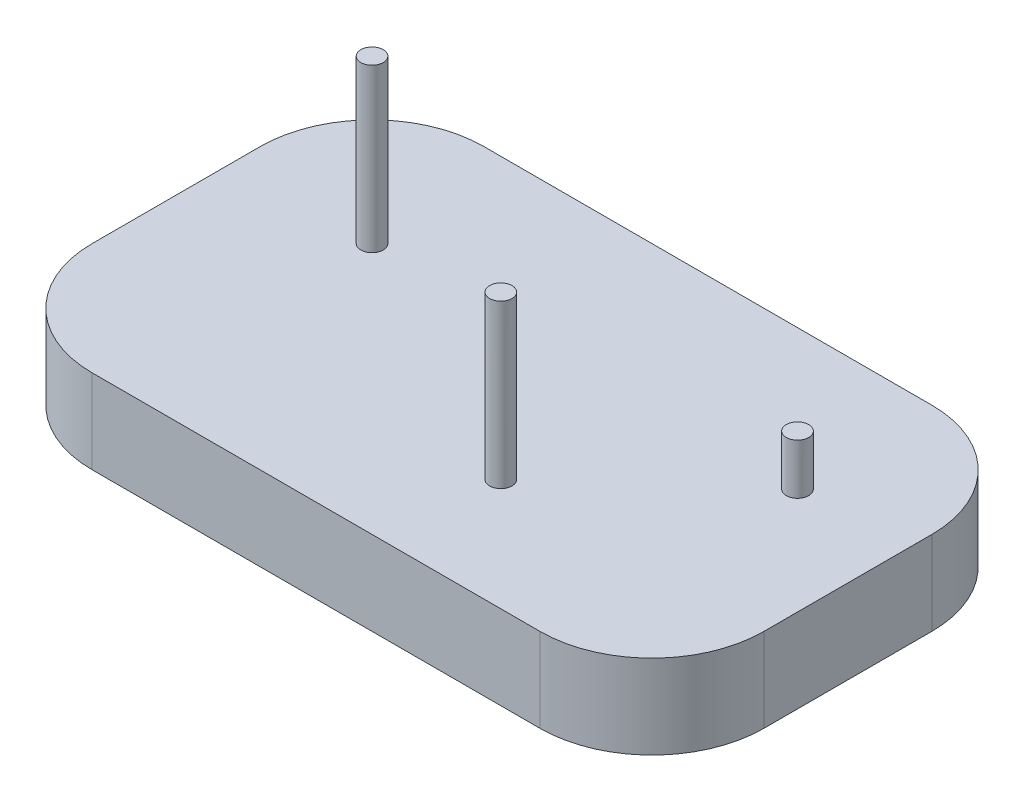
from build123d import *

# Parameters (mm, degrees)
SKETCH1_W           = 120
SKETCH1_H           = 70
BOSS_EXTRUDE1_DEPTH = 15
FILLET1_R           = 20
SKETCH2_R           = 2
BOSS_EXTRUDE3_DEPTH = 9
SKETCH6_R           = 2
BOSS_EXTRUDE4_DEPTH = 20


with BuildPart() as part:
    # Sketch1 → Boss-Extrude1 (new body)
    with BuildSketch(Plane(origin=(0, 0, 0), x_dir=(1, 0, 0), z_dir=(0, 1, 0))):
        with Locations((60, 35)):
            Rectangle(SKETCH1_W, SKETCH1_H)
    extrude(amount=BOSS_EXTRUDE1_DEPTH)

    # Fillet1
    fillet1_edges = [part.edges().sort_by_distance(p)[0] for p in [
        (0, 7.5, -70),
        (120, 7.5, -70),
        (120, 7.5, 0),
        (0, 7.5, 0),
    ]]
    fillet(fillet1_edges, radius=FILLET1_R)

    # Sketch2 → Boss-Extrude3 (add)
    with BuildSketch(Plane(origin=(0, 15, 0), x_dir=(1, 0, 0), z_dir=(0, 1, 0))):
        with Locations(Location((25, 45, 0), (0, 0, 90))):
            Circle(SKETCH2_R)
        with Locations(Location((73, 20, 0), (0, 0, 90))):
            Circle(SKETCH2_R)
        with Locations(Location((101, 45, 0), (0, 0, 90))):
            Circle(SKETCH2_R)
    extrude(amount=BOSS_EXTRUDE3_DEPTH)

    # Sketch6 → Boss-Extrude4 (add)
    with BuildSketch(Plane(origin=(0, 24, 0), x_dir=(1, 0, 0), z_dir=(0, 1, 0))):
        with Locations(Location((25, 45, 0), (0, 0, 90))):
            Circle(SKETCH6_R)
        with Locations(Location((73, 20, 0), (0, 0, 90))):
            Circle(SKETCH6_R)
    extrude(amount=BOSS_EXTRUDE4_DEPTH)


solid = part.part
